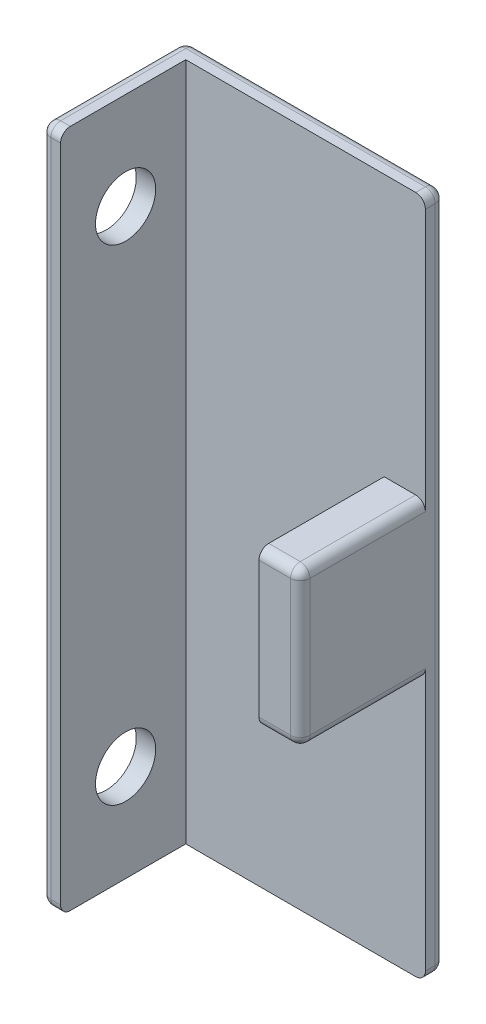
from build123d import *

# Parameters (mm, degrees)
SKETCH1_W           = 26.7
SKETCH1_H           = 70
BOSS_EXTRUDE1_DEPTH = 2
SKETCH2_W           = 2
SKETCH2_H           = 70
BOSS_EXTRUDE2_DEPTH = 12.9
SKETCH3_R           = 3.1
CUT_EXTRUDE1_DEPTH  = 77.386517135
FILLET1_R           = 1
FILLET2_R           = 1
FILLET3_R           = 1
FILLET6_R           = 1
FILLET7_R           = 1
FILLET8_R           = 1
CUT_EXTRUDE2_REACH  = 77.711
SKETCH5_W           = 12.9
SKETCH5_H           = 27
SKETCH6_W           = 12.9
SKETCH6_H           = 16
BOSS_EXTRUDE3_DEPTH = 2.25
FILLET11_R          = 1
FILLET12_R          = 1


with BuildPart() as part:
    # Sketch1 → Boss-Extrude1 (new body)
    with BuildSketch(Plane.XY):
        with Locations((13.35, 35)):
            Rectangle(SKETCH1_W, SKETCH1_H)
    extrude(amount=BOSS_EXTRUDE1_DEPTH)

    # Sketch2 → Boss-Extrude2 (add)
    with BuildSketch(Plane.XY.offset(2)):
        with Locations((1, 35)):
            Rectangle(SKETCH2_W, SKETCH2_H)
        with Locations((25.7, 35)):
            Rectangle(SKETCH2_W, SKETCH2_H)
    extrude(amount=BOSS_EXTRUDE2_DEPTH)

    # Sketch3 → Cut-Extrude1 (cut, through all)
    with BuildSketch(Plane.ZY):
        with Locations((8.2, 10)):
            Circle(SKETCH3_R)
    cut_extrude1 = extrude(amount=-CUT_EXTRUDE1_DEPTH, mode=Mode.SUBTRACT)

    # Mirror1: Cut-Extrude1 across plane
    add(cut_extrude1.mirror(Plane.ZX.offset(35)), mode=Mode.SUBTRACT)

    # Fillet1
    fillet1_edges = [part.edges().sort_by_distance(p)[0] for p in [
        (13.35, 70, 0),
    ]]
    fillet(fillet1_edges, radius=FILLET1_R)

    # Fillet2
    fillet2_edges = [part.edges().sort_by_distance(p)[0] for p in [
        (0, 34.5, 0),
        (0, 69.707106781, 0.292893219),
        (0, 70, 7.95),
    ]]
    fillet(fillet2_edges, radius=FILLET2_R)

    # Fillet3
    fillet3_edges = [part.edges().sort_by_distance(p)[0] for p in [
        (26.7, 34.5, 0),
        (26.7, 69.707106781, 0.292893219),
        (26.7, 70, 7.95),
    ]]
    fillet(fillet3_edges, radius=FILLET3_R)

    # Fillet6
    fillet6_edges = [part.edges().sort_by_distance(p)[0] for p in [
        (13.35, 0, 0),
        (0.292893219, 0, 0.292893219),
        (26.7, 0, 7.95),
        (0, 0, 7.95),
        (26.407106781, 0, 0.292893219),
    ]]
    fillet(fillet6_edges, radius=FILLET6_R)

    # Fillet7
    fillet7_edges = [part.edges().sort_by_distance(p)[0] for p in [
        (1.5, 70, 14.9),
        (0, 35, 14.9),
        (0.292893219, 69.707106781, 14.9),
        (1.5, 0, 14.9),
        (0.292893219, 0.292893219, 14.9),
    ]]
    fillet(fillet7_edges, radius=FILLET7_R)

    # Fillet8
    fillet8_edges = [part.edges().sort_by_distance(p)[0] for p in [
        (25.2, 0, 14.9),
        (25.2, 70, 14.9),
        (26.407106781, 69.707106781, 14.9),
        (26.7, 35, 14.9),
        (26.407106781, 0.292893219, 14.9),
    ]]
    fillet(fillet8_edges, radius=FILLET8_R)

    # Cut-Extrude2: up to this face of the body (flat: up to its plane)
    cut_extrude2_end = Plane(part.part.faces().sort_by_distance((26.7, 35, 7.394557998))[0])
    # Sketch5 → Cut-Extrude2 (cut, up to the picked face)
    with BuildSketch(Plane.ZY.offset(-24.7), mode=Mode.PRIVATE) as cut_extrude2_sk1:
        with Locations((8.45, 56.5)):
            Rectangle(SKETCH5_W, SKETCH5_H)
    cut_extrude2_tool1 = split(extrude(cut_extrude2_sk1.sketch, amount=-CUT_EXTRUDE2_REACH, mode=Mode.PRIVATE), bisect_by=cut_extrude2_end, keep=Keep.BOTH, mode=Mode.PRIVATE)
    # Sketch5 → Cut-Extrude2 (cut, up to the picked face)
    with BuildSketch(Plane.ZY.offset(-24.7), mode=Mode.PRIVATE) as cut_extrude2_sk2:
        with Locations((8.45, 13.5)):
            Rectangle(SKETCH5_W, SKETCH5_H)
    cut_extrude2_tool2 = split(extrude(cut_extrude2_sk2.sketch, amount=-CUT_EXTRUDE2_REACH, mode=Mode.PRIVATE), bisect_by=cut_extrude2_end, keep=Keep.BOTH, mode=Mode.PRIVATE)
    add(cut_extrude2_tool1.solids().sort_by(Axis((24.7, 56.5, 8.45), (1, 0, 0)))[0], mode=Mode.SUBTRACT)
    add(cut_extrude2_tool2.solids().sort_by(Axis((24.7, 13.5, 8.45), (1, 0, 0)))[0], mode=Mode.SUBTRACT)

    # Sketch6 → Boss-Extrude3 (add)
    with BuildSketch(Plane.ZY.offset(-24.7)):
        with Locations((8.45, 35)):
            Rectangle(SKETCH6_W, SKETCH6_H)
    extrude(amount=BOSS_EXTRUDE3_DEPTH)

    # Fillet11
    fillet11_edges = [part.edges().sort_by_distance(p)[0] for p in [
        (24.075, 27, 14.9),
        (26.407106781, 27, 14.607106781),
        (26.7, 27, 7.95),
    ]]
    fillet(fillet11_edges, radius=FILLET11_R)

    # Fillet12
    fillet12_edges = [part.edges().sort_by_distance(p)[0] for p in [
        (24.075, 43, 14.9),
        (26.407106781, 43, 14.607106781),
        (26.7, 43, 7.95),
    ]]
    fillet(fillet12_edges, radius=FILLET12_R)


solid = part.part
